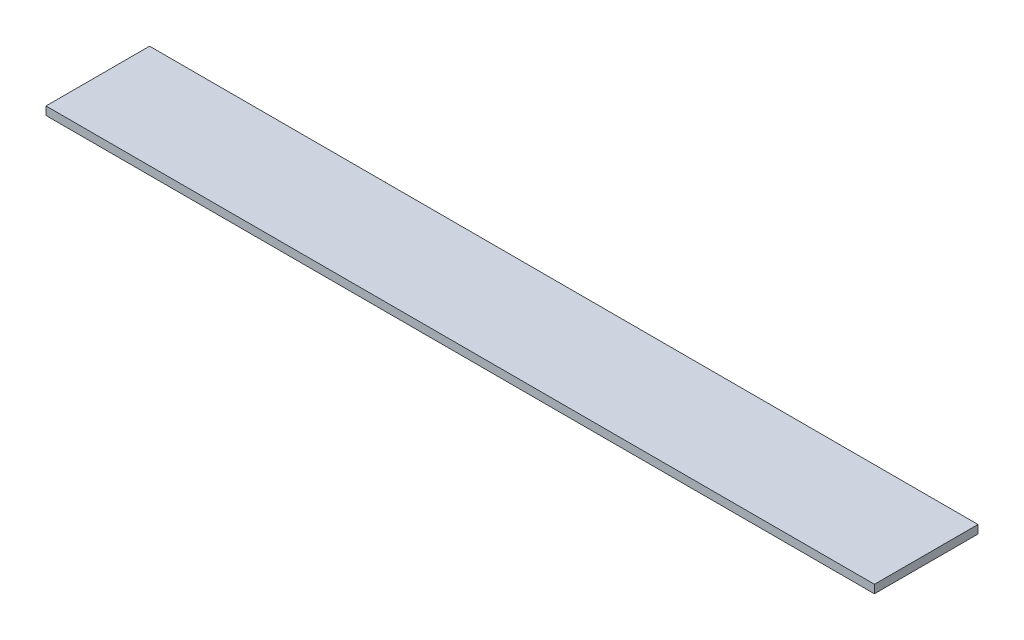
from build123d import *

# Parameters (mm, degrees)
SKETCH1_W           = 200
SKETCH1_H           = 25
BOSS_EXTRUDE1_DEPTH = 2


with BuildPart() as part:
    # Sketch1 → Boss-Extrude1 (new body)
    with BuildSketch(Plane(origin=(0, 0, 0), x_dir=(1, 0, 0), z_dir=(0, 1, 0))):
        Rectangle(SKETCH1_W, SKETCH1_H)
    extrude(amount=BOSS_EXTRUDE1_DEPTH)


solid = part.part
